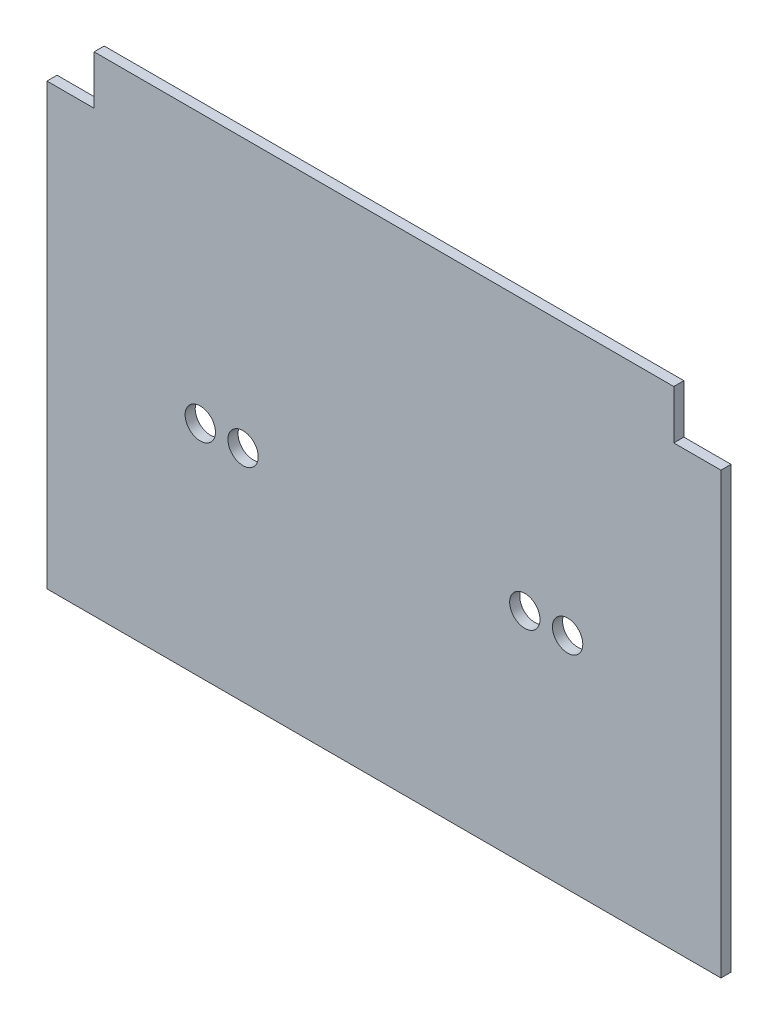
from build123d import *

# Parameters (mm, degrees)
SKETCH1_W           = 400
SKETCH1_H           = 281
BOSS_EXTRUDE1_DEPTH = 6
SKETCH2_W           = 28
SKETCH2_H           = 20
CUT_EXTRUDE1_DEPTH  = 10
SKETCH3_W           = 344
SKETCH3_H           = 9
BOSS_EXTRUDE2_DEPTH = 6
SKETCH4_R           = 9
CUT_EXTRUDE2_DEPTH  = 10


with BuildPart() as part:
    # Sketch1 → Boss-Extrude1 (new body)
    with BuildSketch(Plane.XY):
        with Locations((171.428571429, 117.604761905)):
            Rectangle(SKETCH1_W, SKETCH1_H)
    extrude(amount=BOSS_EXTRUDE1_DEPTH)

    # Sketch2 → Cut-Extrude1 (cut)
    with BuildSketch(Plane.XY.offset(6)):
        with Locations((-14.571428571, 248.104761905)):
            Rectangle(SKETCH2_W, SKETCH2_H)
        with Locations((357.428571429, 248.104761905)):
            Rectangle(SKETCH2_W, SKETCH2_H)
    extrude(amount=-CUT_EXTRUDE1_DEPTH, mode=Mode.SUBTRACT)

    # Sketch3 → Boss-Extrude2 (add)
    with BuildSketch(Plane.XY.offset(6)):
        with Locations((171.428571429, 262.604761905)):
            Rectangle(SKETCH3_W, SKETCH3_H)
    extrude(amount=-BOSS_EXTRUDE2_DEPTH)

    # Sketch4 → Cut-Extrude2 (cut)
    with BuildSketch(Plane.XY.offset(6)):
        with Locations((62.428571429, 107.604761905)):
            Circle(SKETCH4_R)
        with Locations((87.828571429, 107.604761905)):
            Circle(SKETCH4_R)
        with Locations((255.028571429, 107.604761905)):
            Circle(SKETCH4_R)
        with Locations((280.428571429, 107.604761905)):
            Circle(SKETCH4_R)
    extrude(amount=-CUT_EXTRUDE2_DEPTH, mode=Mode.SUBTRACT)


solid = part.part
